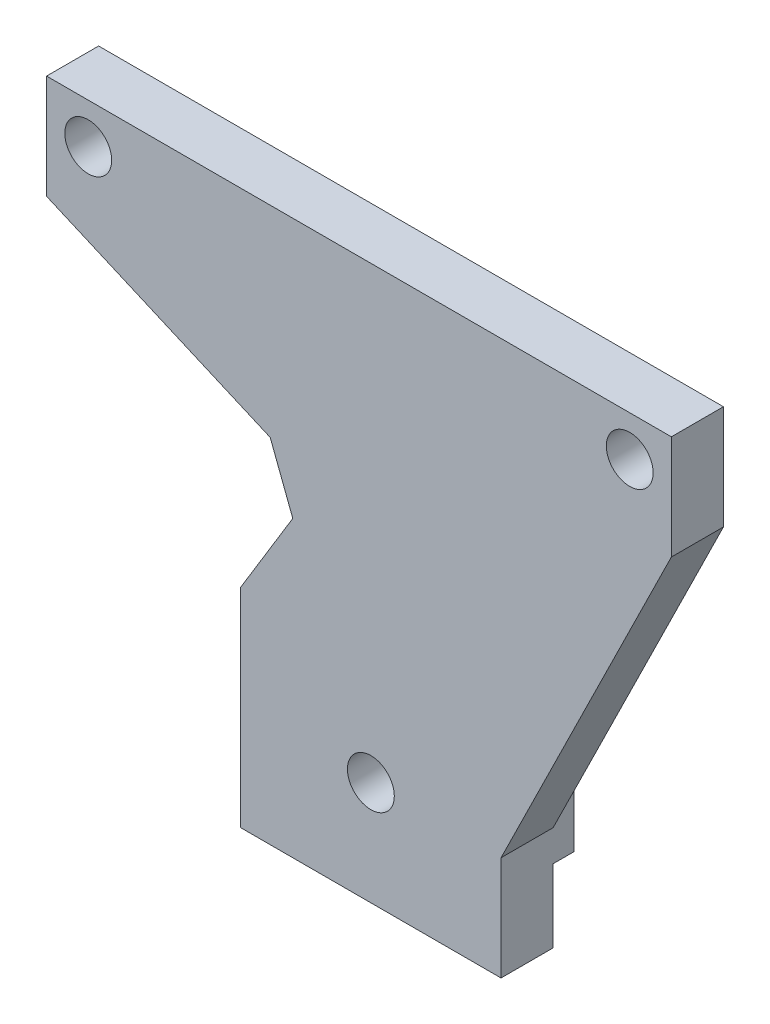
from build123d import *

# Parameters (mm, degrees)
BOSS_EXTRU_1_DEPTH      = 5
ESQUISSE2_W             = 25
ESQUISSE2_H             = 6
BOSS_EXTRU_2_DEPTH      = 2
ESQUISSE3_R             = 2.25
ENL_V_MAT_EXTRU_3_DEPTH = 8.1


with BuildPart() as part:
    # Esquisse1 → Boss.-Extru.1 (new body)
    with BuildSketch(Plane.XY):
        Polygon((0, 0), (60, 0), (60, -10), (38.522739923, -19.314739888), (36.355716988, -24.967843196), (41.356924968, -33.188115427), (41.356924968, -53.188115427), (16.356924968, -53.188115427), (16.356924968, -43.188115427), (0, -10), align=None)
    extrude(amount=BOSS_EXTRU_1_DEPTH)

    # Esquisse2 → Boss.-Extru.2 (add)
    with BuildSketch(Plane(origin=(0, 0, 0), x_dir=(-1, 0, 0), z_dir=(0, 0, -1))):
        with Locations((-28.856924968, -43.188115427)):
            Rectangle(ESQUISSE2_W, ESQUISSE2_H)
    extrude(amount=BOSS_EXTRU_2_DEPTH)

    # Esquisse3 → Enlèv. mat.-Extru.3 (cut)
    with BuildSketch(Plane(origin=(0, 0, -2), x_dir=(-1, 0, 0), z_dir=(0, 0, -1))):
        with Locations((-28.856924968, -43.188115427)):
            Circle(ESQUISSE3_R)
        with Locations(Location((-56, -3.88, 0), (0, 0, 180))):
            Circle(ESQUISSE3_R)
        with Locations(Location((-4, -3.88, 0), (0, 0, 180))):
            Circle(ESQUISSE3_R)
    extrude(amount=-ENL_V_MAT_EXTRU_3_DEPTH, mode=Mode.SUBTRACT)

    # Symétrie1: part across plane


with BuildPart() as part_1:
    add(part.part)
    add(part.part.mirror(Plane(origin=(0, 0, 5), x_dir=(0, 0, 1), z_dir=(1, 0, 0))))

    # Fractionner1
    split(bisect_by=Plane(origin=(0, 0, 0), x_dir=(0, 0, -1), z_dir=(-1, 0, 0)), keep=Keep.TOP)


solid = part_1.part
